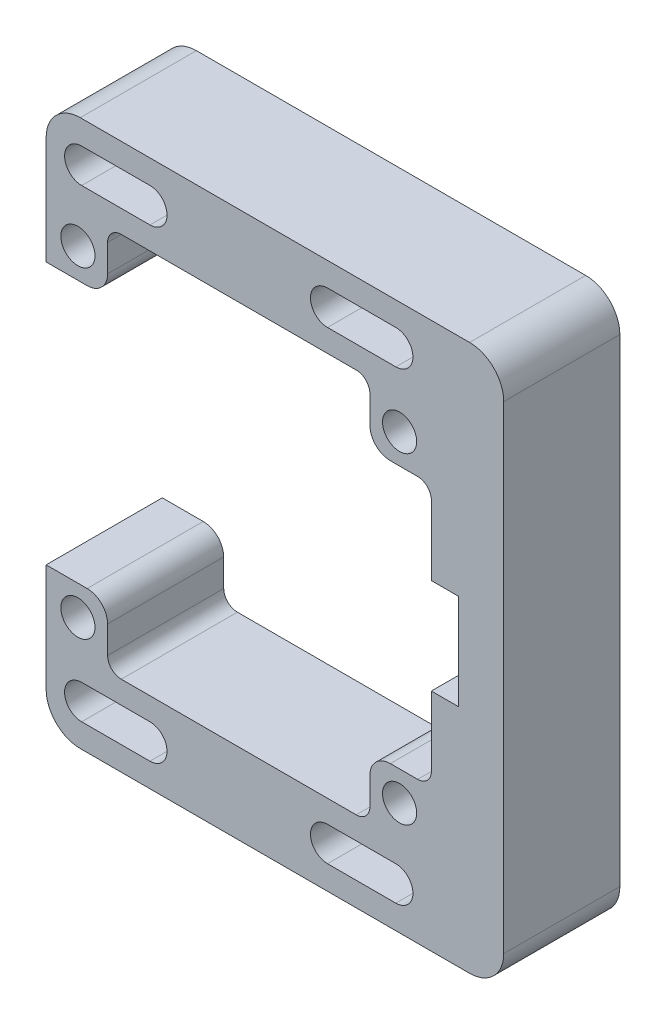
from build123d import *

# Parameters (mm, degrees)
CROQUIS1_W              = 67
CROQUIS1_H              = 80
SALIENTE_EXTRUIR1_DEPTH = 17
CORTAR_EXTRUIR2_DEPTH   = 59.261822835
CROQUIS5_R              = 2.5
CORTAR_EXTRUIR3_DEPTH   = 59.261822835
REDONDEO1_R             = 2
REDONDEO2_R             = 3
REDONDEO3_R             = 5
CROQUIS6_W              = 8
CROQUIS6_H              = 14
CORTAR_EXTRUIR4_DEPTH   = 59.261822835


with BuildPart() as part:
    # Croquis1 → Saliente-Extruir1 (new body)
    with BuildSketch(Plane.XY):
        with Locations((5.3, 0)):
            Rectangle(CROQUIS1_W, CROQUIS1_H)
    extrude(amount=SALIENTE_EXTRUIR1_DEPTH)

    # Croquis4 → Cortar-Extruir2 (cut, through all)
    with BuildSketch(Plane.XY.offset(17)):
        Polygon((-28.2, 19.2), (-19.2, 19.2), (-19.2, 28.2), (19.2, 28.2), (19.2, 19.2), (28.2, 19.2), (28.2, -19.2), (19.2, -19.2), (19.2, -28.2), (-19.2, -28.2), (-19.2, -19.2), (-28.2, -19.2), align=None)
    extrude(amount=-CORTAR_EXTRUIR2_DEPTH, mode=Mode.SUBTRACT)

    # Croquis5 → Cortar-Extruir3 (cut, through all)
    with BuildSketch(Plane.XY.offset(17)):
        with Locations((-23.55, 23.55)):
            Circle(CROQUIS5_R)
        with Locations((23.55, 23.55)):
            Circle(CROQUIS5_R)
        with Locations((23.55, -23.55)):
            Circle(CROQUIS5_R)
        with Locations((-23.55, -23.55)):
            Circle(CROQUIS5_R)
        with BuildLine():
            Line((-23, 36.5), (-13, 36.5))
            ThreePointArc((-13, 36.5), (-10.5, 34), (-13, 31.5))
            Line((-13, 31.5), (-23, 31.5))
            ThreePointArc((-23, 31.5), (-25.5, 34), (-23, 36.5))
        make_face()
        with BuildLine():
            Line((13, 36.5), (23, 36.5))
            ThreePointArc((23, 36.5), (25.5, 34), (23, 31.5))
            Line((23, 31.5), (13, 31.5))
            ThreePointArc((13, 31.5), (10.5, 34), (13, 36.5))
        make_face()
        with BuildLine():
            Line((-23, -31.5), (-13, -31.5))
            ThreePointArc((-13, -31.5), (-10.5, -34), (-13, -36.5))
            Line((-13, -36.5), (-23, -36.5))
            ThreePointArc((-23, -36.5), (-25.5, -34), (-23, -31.5))
        make_face()
        with BuildLine():
            Line((13, -31.5), (23, -31.5))
            ThreePointArc((23, -31.5), (25.5, -34), (23, -36.5))
            Line((23, -36.5), (13, -36.5))
            ThreePointArc((13, -36.5), (10.5, -34), (13, -31.5))
        make_face()
    extrude(amount=-CORTAR_EXTRUIR3_DEPTH, mode=Mode.SUBTRACT)

    # Redondeo1
    redondeo1_edges = [part.edges().sort_by_distance(p)[0] for p in [
        (-19.2, 28.2, 8.5),
        (19.2, 28.2, 8.5),
        (28.2, 19.2, 8.5),
        (28.2, -19.2, 8.5),
        (19.2, -28.2, 8.5),
        (-19.2, -28.2, 8.5),
    ]]
    fillet(redondeo1_edges, radius=REDONDEO1_R)

    # Redondeo2
    redondeo2_edges = [part.edges().sort_by_distance(p)[0] for p in [
        (-19.2, 19.2, 8.5),
        (19.2, 19.2, 8.5),
        (19.2, -19.2, 8.5),
        (-19.2, -19.2, 8.5),
    ]]
    fillet(redondeo2_edges, radius=REDONDEO2_R)

    # Redondeo3
    redondeo3_edges = [part.edges().sort_by_distance(p)[0] for p in [
        (-28.2, 40, 8.5),
        (38.8, 40, 8.5),
        (38.8, -40, 8.5),
        (-28.2, -40, 8.5),
    ]]
    fillet(redondeo3_edges, radius=REDONDEO3_R)

    # Croquis6 → Cortar-Extruir4 (cut, through all)
    with BuildSketch(Plane.XY.offset(17)):
        with Locations((28.2, 0)):
            Rectangle(CROQUIS6_W, CROQUIS6_H)
    extrude(amount=-CORTAR_EXTRUIR4_DEPTH, mode=Mode.SUBTRACT)


solid = part.part
